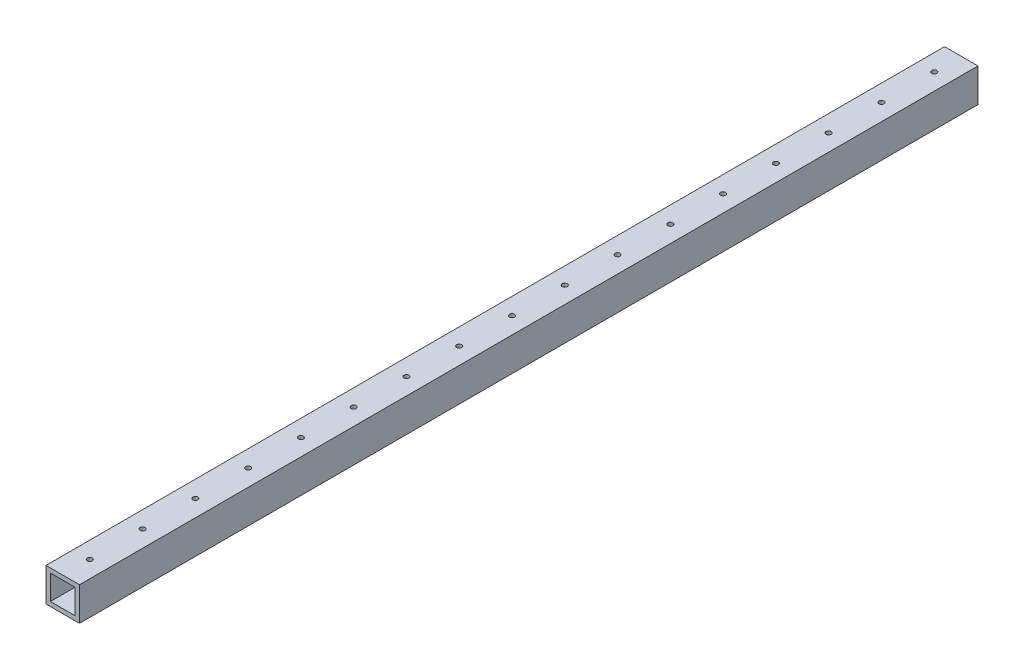
from build123d import *

# Parameters (mm, degrees)
CROQUIS1_W              = 38
CROQUIS1_H              = 38
CROQUIS1_W_2            = 28
CROQUIS1_H_2            = 28
SALIENTE_EXTRUIR1_DEPTH = 1020
CORTAR_EXTRUIR1_REACH   = 1022.884
CROQUIS2_R              = 2.87


with BuildPart() as part:
    # Croquis1 → Saliente-Extruir1 (new body)
    with BuildSketch(Plane.XY):
        Rectangle(CROQUIS1_W, CROQUIS1_H)
        Rectangle(CROQUIS1_W_2, CROQUIS1_H_2, mode=Mode.SUBTRACT)
    extrude(amount=SALIENTE_EXTRUIR1_DEPTH)

    # Cortar-Extruir1: up to this face of the body (flat: up to its plane)
    cortar_extruir1_end = Plane(part.part.faces().sort_by_distance((0, -19, 510))[0])
    # Croquis2 → Cortar-Extruir1 (cut, up to the picked face)
    with BuildSketch(Plane(origin=(0, 19, 0), x_dir=(1, 0, 0), z_dir=(0, 1, 0)), mode=Mode.PRIVATE) as cortar_extruir1_sk1:
        with Locations(Location((0, -30.72, 0), (0, 0, 270))):
            Circle(CROQUIS2_R)
    cortar_extruir1_tool1 = split(extrude(cortar_extruir1_sk1.sketch, amount=-CORTAR_EXTRUIR1_REACH, mode=Mode.PRIVATE), bisect_by=cortar_extruir1_end, keep=Keep.BOTH, mode=Mode.PRIVATE)
    # Croquis2 → Cortar-Extruir1 (cut, up to the picked face)
    with BuildSketch(Plane(origin=(0, 19, 0), x_dir=(1, 0, 0), z_dir=(0, 1, 0)), mode=Mode.PRIVATE) as cortar_extruir1_sk2:
        with Locations(Location((0, -90.63, 0), (0, 0, 270))):
            Circle(CROQUIS2_R)
    cortar_extruir1_tool2 = split(extrude(cortar_extruir1_sk2.sketch, amount=-CORTAR_EXTRUIR1_REACH, mode=Mode.PRIVATE), bisect_by=cortar_extruir1_end, keep=Keep.BOTH, mode=Mode.PRIVATE)
    # Croquis2 → Cortar-Extruir1 (cut, up to the picked face)
    with BuildSketch(Plane(origin=(0, 19, 0), x_dir=(1, 0, 0), z_dir=(0, 1, 0)), mode=Mode.PRIVATE) as cortar_extruir1_sk3:
        with Locations(Location((0, -150.54, 0), (0, 0, 270))):
            Circle(CROQUIS2_R)
    cortar_extruir1_tool3 = split(extrude(cortar_extruir1_sk3.sketch, amount=-CORTAR_EXTRUIR1_REACH, mode=Mode.PRIVATE), bisect_by=cortar_extruir1_end, keep=Keep.BOTH, mode=Mode.PRIVATE)
    # Croquis2 → Cortar-Extruir1 (cut, up to the picked face)
    with BuildSketch(Plane(origin=(0, 19, 0), x_dir=(1, 0, 0), z_dir=(0, 1, 0)), mode=Mode.PRIVATE) as cortar_extruir1_sk4:
        with Locations(Location((0, -210.45, 0), (0, 0, 270))):
            Circle(CROQUIS2_R)
    cortar_extruir1_tool4 = split(extrude(cortar_extruir1_sk4.sketch, amount=-CORTAR_EXTRUIR1_REACH, mode=Mode.PRIVATE), bisect_by=cortar_extruir1_end, keep=Keep.BOTH, mode=Mode.PRIVATE)
    # Croquis2 → Cortar-Extruir1 (cut, up to the picked face)
    with BuildSketch(Plane(origin=(0, 19, 0), x_dir=(1, 0, 0), z_dir=(0, 1, 0)), mode=Mode.PRIVATE) as cortar_extruir1_sk5:
        with Locations(Location((0, -270.36, 0), (0, 0, 270))):
            Circle(CROQUIS2_R)
    cortar_extruir1_tool5 = split(extrude(cortar_extruir1_sk5.sketch, amount=-CORTAR_EXTRUIR1_REACH, mode=Mode.PRIVATE), bisect_by=cortar_extruir1_end, keep=Keep.BOTH, mode=Mode.PRIVATE)
    # Croquis2 → Cortar-Extruir1 (cut, up to the picked face)
    with BuildSketch(Plane(origin=(0, 19, 0), x_dir=(1, 0, 0), z_dir=(0, 1, 0)), mode=Mode.PRIVATE) as cortar_extruir1_sk6:
        with Locations(Location((0, -330.27, 0), (0, 0, 270))):
            Circle(CROQUIS2_R)
    cortar_extruir1_tool6 = split(extrude(cortar_extruir1_sk6.sketch, amount=-CORTAR_EXTRUIR1_REACH, mode=Mode.PRIVATE), bisect_by=cortar_extruir1_end, keep=Keep.BOTH, mode=Mode.PRIVATE)
    # Croquis2 → Cortar-Extruir1 (cut, up to the picked face)
    with BuildSketch(Plane(origin=(0, 19, 0), x_dir=(1, 0, 0), z_dir=(0, 1, 0)), mode=Mode.PRIVATE) as cortar_extruir1_sk7:
        with Locations(Location((0, -390.18, 0), (0, 0, 270))):
            Circle(CROQUIS2_R)
    cortar_extruir1_tool7 = split(extrude(cortar_extruir1_sk7.sketch, amount=-CORTAR_EXTRUIR1_REACH, mode=Mode.PRIVATE), bisect_by=cortar_extruir1_end, keep=Keep.BOTH, mode=Mode.PRIVATE)
    # Croquis2 → Cortar-Extruir1 (cut, up to the picked face)
    with BuildSketch(Plane(origin=(0, 19, 0), x_dir=(1, 0, 0), z_dir=(0, 1, 0)), mode=Mode.PRIVATE) as cortar_extruir1_sk8:
        with Locations(Location((0, -450.09, 0), (0, 0, 270))):
            Circle(CROQUIS2_R)
    cortar_extruir1_tool8 = split(extrude(cortar_extruir1_sk8.sketch, amount=-CORTAR_EXTRUIR1_REACH, mode=Mode.PRIVATE), bisect_by=cortar_extruir1_end, keep=Keep.BOTH, mode=Mode.PRIVATE)
    # Croquis2 → Cortar-Extruir1 (cut, up to the picked face)
    with BuildSketch(Plane(origin=(0, 19, 0), x_dir=(1, 0, 0), z_dir=(0, 1, 0)), mode=Mode.PRIVATE) as cortar_extruir1_sk9:
        with Locations(Location((0, -510, 0), (0, 0, 270))):
            Circle(CROQUIS2_R)
    cortar_extruir1_tool9 = split(extrude(cortar_extruir1_sk9.sketch, amount=-CORTAR_EXTRUIR1_REACH, mode=Mode.PRIVATE), bisect_by=cortar_extruir1_end, keep=Keep.BOTH, mode=Mode.PRIVATE)
    # Croquis2 → Cortar-Extruir1 (cut, up to the picked face)
    with BuildSketch(Plane(origin=(0, 19, 0), x_dir=(1, 0, 0), z_dir=(0, 1, 0)), mode=Mode.PRIVATE) as cortar_extruir1_sk10:
        with Locations(Location((0, -569.91, 0), (0, 0, 270))):
            Circle(CROQUIS2_R)
    cortar_extruir1_tool10 = split(extrude(cortar_extruir1_sk10.sketch, amount=-CORTAR_EXTRUIR1_REACH, mode=Mode.PRIVATE), bisect_by=cortar_extruir1_end, keep=Keep.BOTH, mode=Mode.PRIVATE)
    # Croquis2 → Cortar-Extruir1 (cut, up to the picked face)
    with BuildSketch(Plane(origin=(0, 19, 0), x_dir=(1, 0, 0), z_dir=(0, 1, 0)), mode=Mode.PRIVATE) as cortar_extruir1_sk11:
        with Locations(Location((0, -629.82, 0), (0, 0, 270))):
            Circle(CROQUIS2_R)
    cortar_extruir1_tool11 = split(extrude(cortar_extruir1_sk11.sketch, amount=-CORTAR_EXTRUIR1_REACH, mode=Mode.PRIVATE), bisect_by=cortar_extruir1_end, keep=Keep.BOTH, mode=Mode.PRIVATE)
    # Croquis2 → Cortar-Extruir1 (cut, up to the picked face)
    with BuildSketch(Plane(origin=(0, 19, 0), x_dir=(1, 0, 0), z_dir=(0, 1, 0)), mode=Mode.PRIVATE) as cortar_extruir1_sk12:
        with Locations(Location((0, -689.73, 0), (0, 0, 270))):
            Circle(CROQUIS2_R)
    cortar_extruir1_tool12 = split(extrude(cortar_extruir1_sk12.sketch, amount=-CORTAR_EXTRUIR1_REACH, mode=Mode.PRIVATE), bisect_by=cortar_extruir1_end, keep=Keep.BOTH, mode=Mode.PRIVATE)
    # Croquis2 → Cortar-Extruir1 (cut, up to the picked face)
    with BuildSketch(Plane(origin=(0, 19, 0), x_dir=(1, 0, 0), z_dir=(0, 1, 0)), mode=Mode.PRIVATE) as cortar_extruir1_sk13:
        with Locations(Location((0, -749.64, 0), (0, 0, 270))):
            Circle(CROQUIS2_R)
    cortar_extruir1_tool13 = split(extrude(cortar_extruir1_sk13.sketch, amount=-CORTAR_EXTRUIR1_REACH, mode=Mode.PRIVATE), bisect_by=cortar_extruir1_end, keep=Keep.BOTH, mode=Mode.PRIVATE)
    # Croquis2 → Cortar-Extruir1 (cut, up to the picked face)
    with BuildSketch(Plane(origin=(0, 19, 0), x_dir=(1, 0, 0), z_dir=(0, 1, 0)), mode=Mode.PRIVATE) as cortar_extruir1_sk14:
        with Locations(Location((0, -809.55, 0), (0, 0, 270))):
            Circle(CROQUIS2_R)
    cortar_extruir1_tool14 = split(extrude(cortar_extruir1_sk14.sketch, amount=-CORTAR_EXTRUIR1_REACH, mode=Mode.PRIVATE), bisect_by=cortar_extruir1_end, keep=Keep.BOTH, mode=Mode.PRIVATE)
    # Croquis2 → Cortar-Extruir1 (cut, up to the picked face)
    with BuildSketch(Plane(origin=(0, 19, 0), x_dir=(1, 0, 0), z_dir=(0, 1, 0)), mode=Mode.PRIVATE) as cortar_extruir1_sk15:
        with Locations(Location((0, -869.46, 0), (0, 0, 270))):
            Circle(CROQUIS2_R)
    cortar_extruir1_tool15 = split(extrude(cortar_extruir1_sk15.sketch, amount=-CORTAR_EXTRUIR1_REACH, mode=Mode.PRIVATE), bisect_by=cortar_extruir1_end, keep=Keep.BOTH, mode=Mode.PRIVATE)
    # Croquis2 → Cortar-Extruir1 (cut, up to the picked face)
    with BuildSketch(Plane(origin=(0, 19, 0), x_dir=(1, 0, 0), z_dir=(0, 1, 0)), mode=Mode.PRIVATE) as cortar_extruir1_sk16:
        with Locations(Location((0, -929.37, 0), (0, 0, 270))):
            Circle(CROQUIS2_R)
    cortar_extruir1_tool16 = split(extrude(cortar_extruir1_sk16.sketch, amount=-CORTAR_EXTRUIR1_REACH, mode=Mode.PRIVATE), bisect_by=cortar_extruir1_end, keep=Keep.BOTH, mode=Mode.PRIVATE)
    # Croquis2 → Cortar-Extruir1 (cut, up to the picked face)
    with BuildSketch(Plane(origin=(0, 19, 0), x_dir=(1, 0, 0), z_dir=(0, 1, 0)), mode=Mode.PRIVATE) as cortar_extruir1_sk17:
        with Locations(Location((0, -989.28, 0), (0, 0, 270))):
            Circle(CROQUIS2_R)
    cortar_extruir1_tool17 = split(extrude(cortar_extruir1_sk17.sketch, amount=-CORTAR_EXTRUIR1_REACH, mode=Mode.PRIVATE), bisect_by=cortar_extruir1_end, keep=Keep.BOTH, mode=Mode.PRIVATE)
    add(cortar_extruir1_tool1.solids().sort_by(Axis((0, 19, 30.72), (0, -1, 0)))[0], mode=Mode.SUBTRACT)
    add(cortar_extruir1_tool2.solids().sort_by(Axis((0, 19, 90.63), (0, -1, 0)))[0], mode=Mode.SUBTRACT)
    add(cortar_extruir1_tool3.solids().sort_by(Axis((0, 19, 150.54), (0, -1, 0)))[0], mode=Mode.SUBTRACT)
    add(cortar_extruir1_tool4.solids().sort_by(Axis((0, 19, 210.45), (0, -1, 0)))[0], mode=Mode.SUBTRACT)
    add(cortar_extruir1_tool5.solids().sort_by(Axis((0, 19, 270.36), (0, -1, 0)))[0], mode=Mode.SUBTRACT)
    add(cortar_extruir1_tool6.solids().sort_by(Axis((0, 19, 330.27), (0, -1, 0)))[0], mode=Mode.SUBTRACT)
    add(cortar_extruir1_tool7.solids().sort_by(Axis((0, 19, 390.18), (0, -1, 0)))[0], mode=Mode.SUBTRACT)
    add(cortar_extruir1_tool8.solids().sort_by(Axis((0, 19, 450.09), (0, -1, 0)))[0], mode=Mode.SUBTRACT)
    add(cortar_extruir1_tool9.solids().sort_by(Axis((0, 19, 510), (0, -1, 0)))[0], mode=Mode.SUBTRACT)
    add(cortar_extruir1_tool10.solids().sort_by(Axis((0, 19, 569.91), (0, -1, 0)))[0], mode=Mode.SUBTRACT)
    add(cortar_extruir1_tool11.solids().sort_by(Axis((0, 19, 629.82), (0, -1, 0)))[0], mode=Mode.SUBTRACT)
    add(cortar_extruir1_tool12.solids().sort_by(Axis((0, 19, 689.73), (0, -1, 0)))[0], mode=Mode.SUBTRACT)
    add(cortar_extruir1_tool13.solids().sort_by(Axis((0, 19, 749.64), (0, -1, 0)))[0], mode=Mode.SUBTRACT)
    add(cortar_extruir1_tool14.solids().sort_by(Axis((0, 19, 809.55), (0, -1, 0)))[0], mode=Mode.SUBTRACT)
    add(cortar_extruir1_tool15.solids().sort_by(Axis((0, 19, 869.46), (0, -1, 0)))[0], mode=Mode.SUBTRACT)
    add(cortar_extruir1_tool16.solids().sort_by(Axis((0, 19, 929.37), (0, -1, 0)))[0], mode=Mode.SUBTRACT)
    add(cortar_extruir1_tool17.solids().sort_by(Axis((0, 19, 989.28), (0, -1, 0)))[0], mode=Mode.SUBTRACT)


solid = part.part
